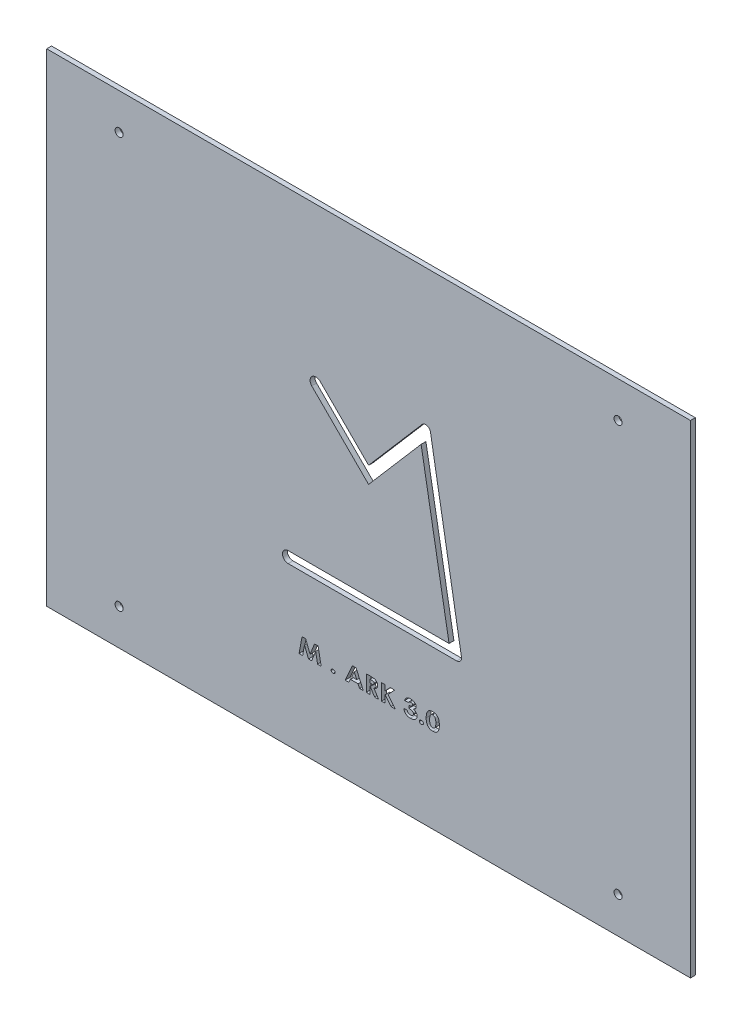
from build123d import *

# Parameters (mm, degrees)
SKETCH1_W           = 400
SKETCH1_H           = 300
BOSS_EXTRUDE1_DEPTH = 3
SKETCH2_R           = 2.5
CUT_EXTRUDE1_DEPTH  = 251.017999352
CUT_EXTRUDE2_DEPTH  = 251.017999352
CUT_EXTRUDE3_DEPTH  = 251.017999352


with BuildPart() as part:
    # Sketch1 → Boss-Extrude1 (new body)
    with BuildSketch(Plane.XY):
        Rectangle(SKETCH1_W, SKETCH1_H)
    extrude(amount=BOSS_EXTRUDE1_DEPTH)

    # Sketch2 → Cut-Extrude1 (cut, through all)
    with BuildSketch(Plane.XY.offset(3)):
        with Locations((155, 127.5)):
            Circle(SKETCH2_R)
        with Locations(Location((-155, 127.5, 0), (0, 0, 180))):
            Circle(SKETCH2_R)
        with Locations((-155, -127.5)):
            Circle(SKETCH2_R)
        with Locations(Location((155, -127.5, 0), (0, 0, 180))):
            Circle(SKETCH2_R)
    extrude(amount=-CUT_EXTRUDE1_DEPTH, mode=Mode.SUBTRACT)

    # Sketch3 → Cut-Extrude2 (cut, through all)
    with BuildSketch(Plane.XY.offset(3)):
        with BuildLine():
            Line((-50, -45), (50, -45))
            Line((50, -45), (32.635182233, 53.480775301))
            Line((32.635182233, 53.480775301), (0, 15.600108984))
            Line((0, 15.600108984), (-35.355339059, 50.955448044))
            ThreePointArc((-35.355339059, 50.955448044), (-35.164401991, 56.09613258), (-30.023717455, 55.905195512))
            Line((-30.023717455, 55.905195512), (0, 25.881478057))
            Line((0, 25.881478057), (33.218849699, 64.43962527))
            ThreePointArc((33.218849699, 64.43962527), (36.291795481, 65.372851519), (38.44782828, 62.992635231))
            Line((38.44782828, 62.992635231), (57.723152972, -48.488879105))
            ThreePointArc((57.723152972, -48.488879105), (57.061939498, -50.932179768), (54.76701437, -52))
            Line((54.76701437, -52), (-50, -52))
            ThreePointArc((-50, -52), (-53.5, -48.5), (-50, -45))
        make_face()
    extrude(amount=-CUT_EXTRUDE2_DEPTH, mode=Mode.SUBTRACT)

    # Sketch4 → Cut-Extrude3 (cut, through all)
    # profile 1 of 8: a face of its own
    with BuildSketch(Plane.XY.offset(3)):
        Polygon((-41.328125, -87), (-39.086538462, -87), (-36.346153846, -93.975160256), (-33.59775641, -87), (-31.368189103, -87), (-29.487179487, -97), (-31.696714744, -97), (-32.884615385, -90.683894231), (-35.374599359, -97), (-37.327724359, -97), (-39.807692308, -90.683894231), (-40.993589744, -97), (-43.205128205, -97), align=None)
    # profile 2 of 8: a face of its own
    with BuildSketch(Plane.XY.offset(3)):
        with BuildLine():
            add(Edge.make_bspline(
                [(-22.051282051, -94.948717949), (-21.965492792, -94.952546553), (-21.798510579, -94.959998637), (-21.557360282, -95.01879729), (-21.33803169, -95.121130381), (-21.143253871, -95.258736103), (-20.978406375, -95.422518732), (-20.857007337, -95.609884484), (-20.782654227, -95.816780635), (-20.773756298, -95.961069257), (-20.769230769, -96.034455128)],
                knots=[0, 0, 0, 0, 1.104023621, 2.148897298, 3.172284594, 4.202907706, 5.206191934, 6.146002102, 7.057047959, 8, 8, 8, 8], degree=3))
            add(Edge.make_bspline(
                [(-20.769230769, -96.034455128), (-20.773732034, -96.107855301), (-20.782582257, -96.252172042), (-20.857481369, -96.459396973), (-20.97821469, -96.64838034), (-21.14323076, -96.813934245), (-21.337375083, -96.954191289), (-21.557745391, -97.055420601), (-21.79816046, -97.117618668), (-21.965429006, -97.124614443), (-22.051282051, -97.128205128)],
                knots=[0, 0, 0, 0, 0.940548371, 1.84927189, 2.79391768, 3.800764035, 4.83372162, 5.854500209, 6.898790635, 8, 8, 8, 8], degree=3))
            add(Edge.make_bspline(
                [(-22.051282051, -97.128205128), (-22.137129782, -97.124606037), (-22.304387975, -97.117593884), (-22.544877073, -97.055512918), (-22.765470913, -96.953622083), (-22.961004493, -96.814530517), (-23.126631533, -96.648927401), (-23.244742455, -96.458776785), (-23.320100559, -96.252244256), (-23.328872091, -96.107879647), (-23.333333333, -96.034455128)],
                knots=[0, 0, 0, 0, 1.100875723, 2.144849751, 3.165319067, 4.204952963, 5.211494265, 6.151288399, 7.059736594, 8, 8, 8, 8], degree=3))
            add(Edge.make_bspline(
                [(-23.333333333, -96.034455128), (-23.328847989, -95.961044524), (-23.32002907, -95.816707273), (-23.245216503, -95.610511181), (-23.126435062, -95.421967893), (-22.96097294, -95.258143226), (-22.764819781, -95.121701974), (-22.545260995, -95.01870547), (-22.304038151, -94.960023325), (-22.137066093, -94.952554932), (-22.051282051, -94.948717949)],
                knots=[0, 0, 0, 0, 0.94266584, 1.85343518, 2.788347505, 3.79132722, 4.828678245, 5.851754927, 6.896311468, 8, 8, 8, 8], degree=3))
        make_face()
    # profile 3 of 8: a face of its own
    with BuildSketch(Plane.XY.offset(3)):
        Polygon((-10.028044872, -87), (-7.792467949, -87), (-3.269230769, -97), (-5.600961538, -97), (-6.510416667, -94.948717949), (-11.312099359, -94.948717949), (-12.219551282, -97), (-14.551282051, -97), align=None)
        Polygon((-8.91025641, -89.682291667), (-10.514823718, -93.153846154), (-7.301682692, -93.153846154), align=None, mode=Mode.SUBTRACT)
    # profile 4 of 8: a face of its own
    with BuildSketch(Plane.XY.offset(3)):
        with BuildLine():
            Line((-1.41025641, -87), (0.985576923, -87))
            add(Edge.make_bspline(
                [(0.985576923, -87), (1.143844199, -87.000492961), (1.448427932, -87.001441659), (1.887875497, -87.016324081), (2.29209751, -87.037071862), (2.660980566, -87.06857244), (2.993750693, -87.110349308), (3.291196299, -87.160211102), (3.554109452, -87.21626818), (3.785364304, -87.286038508), (3.993532596, -87.365199947), (4.187179201, -87.456554328), (4.371370087, -87.557662579), (4.544444005, -87.672822218), (4.707244652, -87.79927066), (4.859887471, -87.937942479), (5.002504161, -88.08863013), (5.13426807, -88.250743335), (5.254387386, -88.421200191), (5.357426327, -88.602020793), (5.445066858, -88.789608289), (5.518567163, -88.9847556), (5.571452591, -89.188559363), (5.61190344, -89.398550952), (5.636663189, -89.616932157), (5.639552353, -89.765026363), (5.641025641, -89.840544872)],
                knots=[0, 0, 0, 0, 1.836570219, 3.53446034, 5.10207051, 6.533260598, 7.829841073, 8.992934726, 10.032625301, 10.947036066, 11.793235874, 12.614808957, 13.429924994, 14.229421483, 15.024587688, 15.82001815, 16.620302857, 17.429949247, 18.242519826, 19.037383916, 19.841635455, 20.64338194, 21.453510251, 22.281780062, 23.123818469, 24, 24, 24, 24], degree=3))
            add(Edge.make_bspline(
                [(5.641025641, -89.840544872), (5.639700988, -89.919414321), (5.637100179, -90.074265819), (5.610290731, -90.301434081), (5.5668406, -90.518804665), (5.503475747, -90.726053816), (5.42677361, -90.924837764), (5.328814401, -91.112710707), (5.215325414, -91.290772343), (5.083101275, -91.458425368), (4.93554255, -91.617306356), (4.766856245, -91.76341326), (4.583273025, -91.902519326), (4.378797911, -92.028007271), (4.158930126, -92.146149863), (3.920886504, -92.254896347), (3.665091635, -92.352624879), (3.486569129, -92.408284344), (3.395432692, -92.436698718)],
                knots=[0, 0, 0, 0, 1.016086139, 1.994973482, 2.943504488, 3.869195015, 4.784910831, 5.685580803, 6.595129019, 7.502394393, 8.433946935, 9.385206858, 10.374891841, 11.399326033, 12.473554863, 13.590341435, 14.769859888, 16, 16, 16, 16], degree=3))
            Line((3.395432692, -92.436698718), (6.217948718, -97))
            Line((6.217948718, -97), (3.760016026, -97))
            Line((3.760016026, -97), (1.063701923, -92.641025641))
            Line((1.063701923, -92.641025641), (0.769230769, -92.641025641))
            Line((0.769230769, -92.641025641), (0.769230769, -97))
            Line((0.769230769, -97), (-1.41025641, -97))
            Line((-1.41025641, -97), (-1.41025641, -87))
        make_face()
        with BuildLine():
            Line((0.769230769, -90.846153846), (1.502403846, -90.846153846))
            add(Edge.make_bspline(
                [(1.502403846, -90.846153846), (1.591883707, -90.845192522), (1.763556746, -90.843348157), (2.010919586, -90.834735591), (2.236057963, -90.814302059), (2.439778838, -90.787993837), (2.621920902, -90.758559376), (2.781305836, -90.714965698), (2.920358792, -90.668720013), (3.038794493, -90.61206344), (3.139465541, -90.546333296), (3.226724421, -90.472412691), (3.29921512, -90.386542966), (3.360955338, -90.292586411), (3.403628226, -90.185664675), (3.438524745, -90.072094241), (3.458907272, -89.947433069), (3.460637886, -89.861318569), (3.461538462, -89.81650641)],
                knots=[0, 0, 0, 0, 1.708363675, 3.277608857, 4.723712974, 6.021838054, 7.199660436, 8.241690857, 9.172961181, 9.993967569, 10.739999558, 11.46313589, 12.168296226, 12.87908003, 13.598837728, 14.357076655, 15.145057537, 16, 16, 16, 16], degree=3))
            add(Edge.make_bspline(
                [(3.461538462, -89.81650641), (3.45969929, -89.763454538), (3.456080663, -89.659073342), (3.413413676, -89.509546122), (3.349115799, -89.369370461), (3.255365373, -89.24457729), (3.142721386, -89.131000341), (3.009655345, -89.035227064), (2.859383338, -88.956265546), (2.719795839, -88.906006995), (2.592130095, -88.874691081), (2.477160464, -88.85296137), (2.343310502, -88.835657359), (2.192425365, -88.819432909), (2.022706278, -88.807721238), (1.835005367, -88.799872694), (1.6286175, -88.796476019), (1.485043251, -88.795421228), (1.41025641, -88.794871795)],
                knots=[0, 0, 0, 0, 0.985252127, 1.938513972, 2.873098658, 3.843165384, 4.828025027, 5.842890392, 6.883115312, 7.980634618, 8.595920604, 9.330050158, 10.158404267, 11.108741491, 12.156004298, 13.326020887, 14.60714262, 16, 16, 16, 16], degree=3))
            Line((1.41025641, -88.794871795), (0.769230769, -88.794871795))
            Line((0.769230769, -88.794871795), (0.769230769, -90.846153846))
        make_face(mode=Mode.SUBTRACT)
    # profile 5 of 8: a face of its own
    with BuildSketch(Plane.XY.offset(3)):
        Polygon((8.076923077, -87), (10.256410256, -87), (10.256410256, -90.371394231), (13.417467949, -87), (16.197916667, -87), (12.049278846, -91.423076923), (16.602564103, -97), (13.956330128, -97), (10.256410256, -92.466746795), (10.256410256, -97), (8.076923077, -97), align=None)
    # profile 6 of 8: a face of its own
    with BuildSketch(Plane.XY.offset(3)):
        with BuildLine():
            Line((24.615384615, -89.435897436), (22.435897436, -89.435897436))
            add(Edge.make_bspline(
                [(22.435897436, -89.435897436), (22.451619837, -89.34605695), (22.482546857, -89.169334678), (22.556337578, -88.914502438), (22.645647584, -88.672545609), (22.756913982, -88.444754686), (22.8871191, -88.230230856), (23.036223151, -88.029365832), (23.202470589, -87.840717401), (23.328104896, -87.729255317), (23.391426282, -87.673076923)],
                knots=[0, 0, 0, 0, 1.067174566, 2.09920409, 3.101182624, 4.083726143, 5.062529949, 6.035131793, 7.009679911, 8, 8, 8, 8], degree=3))
            add(Edge.make_bspline(
                [(23.391426282, -87.673076923), (23.484145868, -87.598323866), (23.668520722, -87.449675834), (23.970491906, -87.261791178), (24.288061556, -87.099383753), (24.625298535, -86.971135455), (24.978517092, -86.866742013), (25.350349108, -86.796640554), (25.73936179, -86.750681565), (26.004804928, -86.745980805), (26.139823718, -86.743589744)],
                knots=[0, 0, 0, 0, 0.963513775, 1.91596748, 2.873425474, 3.847303723, 4.832772883, 5.851708161, 6.907262155, 8, 8, 8, 8], degree=3))
            add(Edge.make_bspline(
                [(26.139823718, -86.743589744), (26.260760658, -86.745878739), (26.49784945, -86.750366163), (26.845746053, -86.786140903), (27.177930399, -86.85001921), (27.496780557, -86.931336905), (27.798948777, -87.044581678), (28.088783259, -87.174965269), (28.361917665, -87.334430147), (28.616188185, -87.516131458), (28.849663836, -87.711554753), (29.052594902, -87.921186261), (29.227429097, -88.137712076), (29.368517708, -88.366196467), (29.47990623, -88.603197333), (29.558444093, -88.849610396), (29.605988825, -89.104870358), (29.612227329, -89.278109504), (29.615384615, -89.365785256)],
                knots=[0, 0, 0, 0, 1.203972995, 2.36030863, 3.476442814, 4.569752457, 5.631894405, 6.684988858, 7.730607218, 8.774702771, 9.793625368, 10.75742121, 11.675248853, 12.558950514, 13.424459788, 14.275965966, 15.127472144, 16, 16, 16, 16], degree=3))
            add(Edge.make_bspline(
                [(29.615384615, -89.365785256), (29.610015432, -89.474499037), (29.599384033, -89.689760763), (29.512820719, -90.004612496), (29.372974395, -90.303679556), (29.177803977, -90.585595157), (28.931598504, -90.847969797), (28.631247009, -91.081313002), (28.283617999, -91.292814884), (28.026419519, -91.403540034), (27.892628205, -91.461137821)],
                knots=[0, 0, 0, 0, 0.902812238, 1.787638331, 2.694283822, 3.636788598, 4.626642246, 5.674130132, 6.790112658, 8, 8, 8, 8], degree=3))
            add(Edge.make_bspline(
                [(27.892628205, -91.461137821), (27.978507877, -91.484535751), (28.146768607, -91.530378415), (28.387725034, -91.620118045), (28.615649818, -91.720181708), (28.829176691, -91.83313606), (29.027112987, -91.961241265), (29.211722389, -92.099161975), (29.383209047, -92.249275577), (29.537082605, -92.413892773), (29.674247002, -92.588382729), (29.798894362, -92.767542811), (29.897936354, -92.958649227), (29.984045418, -93.154539334), (30.046530937, -93.360753), (30.096799326, -93.573087003), (30.121264542, -93.794304246), (30.1258755, -93.943733517), (30.128205128, -94.019230769)],
                knots=[0, 0, 0, 0, 1.161439999, 2.275564601, 3.352689833, 4.409483066, 5.425027258, 6.427468076, 7.415594393, 8.396117101, 9.364043735, 10.311781116, 11.239872671, 12.169273241, 13.101123259, 14.048499788, 15.01402915, 16, 16, 16, 16], degree=3))
            add(Edge.make_bspline(
                [(30.128205128, -94.019230769), (30.125009633, -94.130324511), (30.118691921, -94.349964412), (30.060263065, -94.672017037), (29.968201081, -94.980747081), (29.838748645, -95.276378002), (29.670410668, -95.557723147), (29.467324816, -95.828044444), (29.224120284, -96.082429819), (28.949755785, -96.323016049), (28.646824481, -96.543187889), (28.318806587, -96.732525386), (27.972501973, -96.896870274), (27.605168338, -97.028201856), (27.217693639, -97.130553064), (26.810522781, -97.204212808), (26.382560641, -97.24920096), (26.090523021, -97.25397449), (25.94150641, -97.256410256)],
                knots=[0, 0, 0, 0, 0.904771238, 1.788794425, 2.658307691, 3.52589414, 4.411674647, 5.324918016, 6.275850375, 7.274726454, 8.295875987, 9.322666235, 10.357373388, 11.41613355, 12.497317003, 13.62033306, 14.785738966, 16, 16, 16, 16], degree=3))
            add(Edge.make_bspline(
                [(25.94150641, -97.256410256), (25.800505635, -97.253841249), (25.524529751, -97.24881302), (25.120700188, -97.2058589), (24.736794271, -97.136372801), (24.372582942, -97.038588241), (24.028715893, -96.911010495), (23.702366301, -96.760349453), (23.398560475, -96.576121812), (23.116377706, -96.365927093), (22.85815493, -96.132981407), (22.629951077, -95.877363193), (22.435010973, -95.600102423), (22.267244628, -95.305081059), (22.132586995, -94.988421262), (22.03086337, -94.651077999), (21.957864258, -94.294236557), (21.934809274, -94.04825395), (21.923076923, -93.923076923)],
                knots=[0, 0, 0, 0, 1.163132858, 2.276559241, 3.346385464, 4.379491246, 5.383511434, 6.369379209, 7.340699554, 8.309265972, 9.268764279, 10.205337855, 11.130170369, 12.060239432, 13.000694122, 13.962719923, 14.963257337, 16, 16, 16, 16], degree=3))
            Line((21.923076923, -93.923076923), (24.102564103, -93.923076923))
            add(Edge.make_bspline(
                [(24.102564103, -93.923076923), (24.116401681, -93.98605532), (24.143433086, -94.10908223), (24.197469508, -94.28621867), (24.263371754, -94.450328346), (24.340347042, -94.602533515), (24.427633313, -94.742971507), (24.528292552, -94.869502193), (24.640225063, -94.983083164), (24.802864217, -95.119366788), (25.03519483, -95.259885874), (25.347580704, -95.377551873), (25.693273716, -95.448711357), (25.934476738, -95.457155004), (26.059695513, -95.461538462)],
                knots=[0, 0, 0, 0, 0.847238011, 1.65506076, 2.430783259, 3.168647505, 3.894249557, 4.600105461, 5.288952951, 5.986742919, 7.384996884, 8.832294932, 10.355509216, 12, 12, 12, 12], degree=3))
            add(Edge.make_bspline(
                [(26.059695513, -95.461538462), (26.126521614, -95.460591038), (26.257154551, -95.458738998), (26.448735077, -95.438177604), (26.630837189, -95.404291442), (26.804141139, -95.357707688), (26.970076886, -95.300646509), (27.125920946, -95.225173736), (27.27462012, -95.139735892), (27.412329701, -95.041308132), (27.53867908, -94.934926717), (27.646248626, -94.817694718), (27.740556927, -94.696781423), (27.816424345, -94.568844611), (27.875370313, -94.434870707), (27.91729679, -94.295654679), (27.944829398, -94.150522991), (27.947410494, -94.051408423), (27.948717949, -94.001201923)],
                knots=[0, 0, 0, 0, 1.207695902, 2.360827, 3.478340193, 4.552977425, 5.602922823, 6.645067005, 7.678223387, 8.69981991, 9.701465816, 10.658091572, 11.570750188, 12.46924822, 13.339487348, 14.210145001, 15.093348681, 16, 16, 16, 16], degree=3))
            add(Edge.make_bspline(
                [(27.948717949, -94.001201923), (27.946427917, -93.946245833), (27.941853959, -93.836480181), (27.904440248, -93.676564817), (27.84553538, -93.52222991), (27.760467571, -93.376481778), (27.651892015, -93.236735898), (27.522331789, -93.101903514), (27.364487025, -92.978451204), (27.18807851, -92.857623137), (26.986545711, -92.750867431), (26.765771515, -92.653152078), (26.521385746, -92.574975399), (26.257581512, -92.506051283), (25.972108592, -92.455102468), (25.66643158, -92.418043936), (25.340354776, -92.39056616), (25.115578474, -92.386636163), (25, -92.384615385)],
                knots=[0, 0, 0, 0, 0.712260617, 1.422622151, 2.119222093, 2.848814934, 3.602540981, 4.411216623, 5.267622291, 6.197467531, 7.181999, 8.221696836, 9.325704192, 10.506537076, 11.757125606, 13.084140701, 14.500684618, 16, 16, 16, 16], degree=3))
            Line((25, -92.384615385), (25, -90.717948718))
            add(Edge.make_bspline(
                [(25, -90.717948718), (25.078134891, -90.712773296), (25.229139684, -90.702771191), (25.447674546, -90.68558419), (25.650544761, -90.662658286), (25.837833061, -90.639932572), (26.010166926, -90.611420778), (26.166467437, -90.579801565), (26.308417749, -90.546039225), (26.473065214, -90.496671773), (26.657087411, -90.422640964), (26.856470762, -90.322247621), (27.028740939, -90.204947331), (27.174602161, -90.075505521), (27.288172306, -89.933607327), (27.37327406, -89.787137617), (27.4266963, -89.635162528), (27.432865268, -89.531111202), (27.435897436, -89.479967949)],
                knots=[0, 0, 0, 0, 1.261305243, 2.437619549, 3.530325748, 4.549526295, 5.476041808, 6.342959594, 7.11771268, 7.825439131, 9.109647673, 10.307400883, 11.414149412, 12.457410992, 13.436672637, 14.327804045, 15.178083114, 16, 16, 16, 16], degree=3))
            add(Edge.make_bspline(
                [(27.435897436, -89.479967949), (27.431957966, -89.414587564), (27.424173795, -89.28539961), (27.352422756, -89.101723489), (27.232865826, -88.939844995), (27.07323423, -88.798755105), (26.879170921, -88.680380524), (26.653347393, -88.59705571), (26.400530531, -88.545877457), (26.222886522, -88.541011249), (26.129807692, -88.538461538)],
                knots=[0, 0, 0, 0, 0.873115495, 1.725226968, 2.596508184, 3.546496563, 4.56193057, 5.623390662, 6.75474542, 8, 8, 8, 8], degree=3))
            add(Edge.make_bspline(
                [(26.129807692, -88.538461538), (26.04545482, -88.54157882), (25.879467947, -88.547712906), (25.636123543, -88.595317988), (25.40437962, -88.672908941), (25.189720736, -88.783559194), (24.996187873, -88.915192325), (24.832646061, -89.069056032), (24.703567562, -89.243130746), (24.64463868, -89.37194846), (24.615384615, -89.435897436)],
                knots=[0, 0, 0, 0, 1.084879982, 2.134791974, 3.178249202, 4.21968776, 5.232697662, 6.180875624, 7.096932117, 8, 8, 8, 8], degree=3))
        make_face()
    # profile 7 of 8: a face of its own
    with BuildSketch(Plane.XY.offset(3)):
        with BuildLine():
            add(Edge.make_bspline(
                [(32.820512821, -94.948717949), (32.90630208, -94.952546553), (33.073284293, -94.959998637), (33.31443459, -95.01879729), (33.533763181, -95.121130381), (33.728541, -95.258736103), (33.893388497, -95.422518732), (34.014787535, -95.609884484), (34.089140645, -95.816780635), (34.098038574, -95.961069257), (34.102564103, -96.034455128)],
                knots=[0, 0, 0, 0, 1.104023621, 2.148897298, 3.172284594, 4.202907706, 5.206191934, 6.146002102, 7.057047959, 8, 8, 8, 8], degree=3))
            add(Edge.make_bspline(
                [(34.102564103, -96.034455128), (34.098062838, -96.107855301), (34.089212615, -96.252172042), (34.014313503, -96.459396973), (33.893580182, -96.64838034), (33.728564112, -96.813934245), (33.534419788, -96.954191289), (33.314049481, -97.055420601), (33.073634412, -97.117618668), (32.906365865, -97.124614443), (32.820512821, -97.128205128)],
                knots=[0, 0, 0, 0, 0.940548371, 1.84927189, 2.79391768, 3.800764035, 4.83372162, 5.854500209, 6.898790635, 8, 8, 8, 8], degree=3))
            add(Edge.make_bspline(
                [(32.820512821, -97.128205128), (32.73466509, -97.124606037), (32.567406897, -97.117593884), (32.326917799, -97.055512918), (32.106323959, -96.953622083), (31.910790379, -96.814530517), (31.745163339, -96.648927401), (31.627052417, -96.458776785), (31.551694313, -96.252244256), (31.542922781, -96.107879647), (31.538461538, -96.034455128)],
                knots=[0, 0, 0, 0, 1.100875723, 2.144849751, 3.165319067, 4.204952963, 5.211494265, 6.151288399, 7.059736594, 8, 8, 8, 8], degree=3))
            add(Edge.make_bspline(
                [(31.538461538, -96.034455128), (31.542946882, -95.961044524), (31.551765802, -95.816707273), (31.626578368, -95.610511181), (31.745359809, -95.421967893), (31.910821932, -95.258143226), (32.106975091, -95.121701974), (32.326533876, -95.01870547), (32.56775672, -94.960023325), (32.734728778, -94.952554932), (32.820512821, -94.948717949)],
                knots=[0, 0, 0, 0, 0.94266584, 1.85343518, 2.788347505, 3.79132722, 4.828678245, 5.851754927, 6.896311468, 8, 8, 8, 8], degree=3))
        make_face()
    # profile 8 of 8: a face of its own
    with BuildSketch(Plane.XY.offset(3)):
        with BuildLine():
            add(Edge.make_bspline(
                [(39.835737179, -86.743589744), (39.940631176, -86.74488494), (40.146750821, -86.747430038), (40.450366804, -86.77474525), (40.743288095, -86.816595855), (41.025532396, -86.873329011), (41.295429617, -86.950846392), (41.555003685, -87.042377369), (41.803188475, -87.152798677), (42.040151, -87.279337808), (42.266448166, -87.421538009), (42.478041154, -87.584189771), (42.67755099, -87.763705552), (42.864648534, -87.959402331), (43.034727295, -88.176587808), (43.195130022, -88.408013437), (43.342377665, -88.658110348), (43.474670095, -88.928022132), (43.59399893, -89.220026438), (43.69503453, -89.538581817), (43.783887869, -89.882669813), (43.851947969, -90.255167484), (43.909346327, -90.653914222), (43.944859359, -91.080698885), (43.970316511, -91.533612303), (43.972987163, -91.844377957), (43.974358974, -92.00400641)],
                knots=[0, 0, 0, 0, 0.986878607, 1.939244146, 2.866122373, 3.770685769, 4.645919486, 5.506526465, 6.358927341, 7.19947967, 8.032766199, 8.871060618, 9.707586805, 10.556552813, 11.415253582, 12.300713806, 13.20490608, 14.143531746, 15.127224312, 16.170507414, 17.286127382, 18.469254189, 19.732050249, 21.075816642, 22.49795864, 24, 24, 24, 24], degree=3))
            add(Edge.make_bspline(
                [(43.974358974, -92.00400641), (43.972910558, -92.16562941), (43.970095815, -92.479715252), (43.945814992, -92.93681344), (43.90625356, -93.366586773), (43.851075298, -93.768514844), (43.779103263, -94.143079105), (43.69124908, -94.490365307), (43.588615702, -94.810975096), (43.46684073, -95.104204448), (43.331923569, -95.373004417), (43.187024673, -95.623408669), (43.031519935, -95.855283571), (42.864659889, -96.069375472), (42.685754098, -96.263495423), (42.497826637, -96.441617232), (42.295509196, -96.597179358), (42.084825644, -96.739771822), (41.859103045, -96.860774261), (41.621686966, -96.969112901), (41.368487168, -97.054782793), (41.10308475, -97.13125619), (40.821868935, -97.184979531), (40.5273102, -97.228332493), (40.218065756, -97.251835282), (40.007380311, -97.2548642), (39.899839744, -97.256410256)],
                knots=[0, 0, 0, 0, 1.529996052, 2.973277928, 4.3319599, 5.614837321, 6.812444681, 7.940869391, 9.004374387, 9.996356283, 10.943411785, 11.849826989, 12.733472155, 13.584521289, 14.416696755, 15.230665801, 16.032367232, 16.830096171, 17.636295923, 18.454011992, 19.297680756, 20.164270776, 21.066798043, 22.005483142, 22.981935022, 24, 24, 24, 24], degree=3))
            add(Edge.make_bspline(
                [(39.899839744, -97.256410256), (39.792298675, -97.254853067), (39.580946502, -97.251792696), (39.270386782, -97.228286538), (38.973768088, -97.185125669), (38.689499992, -97.130475757), (38.418734399, -97.055529782), (38.160058762, -96.966028363), (37.91493409, -96.859604854), (37.682736227, -96.737072), (37.464322609, -96.596058382), (37.256720827, -96.43948967), (37.062423015, -96.26520178), (36.881757662, -96.072991282), (36.710587892, -95.866449523), (36.551768483, -95.641862391), (36.408901235, -95.397810879), (36.272109769, -95.138078996), (36.151336492, -94.854564293), (36.050281643, -94.543021704), (35.961483271, -94.204894407), (35.893497482, -93.837004069), (35.836896692, -93.442132365), (35.797867166, -93.018935747), (35.773460469, -92.567865211), (35.770668157, -92.257779019), (35.769230769, -92.098157051)],
                knots=[0, 0, 0, 0, 1.023105099, 2.010724743, 2.960346284, 3.873571896, 4.762817917, 5.630750533, 6.475759109, 7.302737153, 8.125679285, 8.946460815, 9.774219303, 10.605553544, 11.453922483, 12.324617337, 13.219089803, 14.142532874, 15.115994133, 16.146566678, 17.255968662, 18.439589787, 19.703655302, 21.050089352, 22.481484969, 24, 24, 24, 24], degree=3))
            add(Edge.make_bspline(
                [(35.769230769, -92.098157051), (35.772279233, -91.876390498), (35.778162841, -91.448375744), (35.823817931, -90.829541936), (35.901165616, -90.258142128), (36.007305255, -89.733191242), (36.147543188, -89.255941245), (36.316708464, -88.825009087), (36.517319107, -88.439244967), (36.682545093, -88.213462802), (36.762820513, -88.103766026)],
                knots=[0, 0, 0, 0, 1.270554087, 2.452199792, 3.552731428, 4.572428878, 5.517880761, 6.398834259, 7.222069991, 8, 8, 8, 8], degree=3))
            add(Edge.make_bspline(
                [(36.762820513, -88.103766026), (36.857155885, -87.995172643), (37.043456081, -87.780714712), (37.363859988, -87.503877854), (37.707968238, -87.266136631), (38.082782459, -87.075926715), (38.482727496, -86.924458837), (38.910416254, -86.81895418), (39.364465236, -86.756434786), (39.67594666, -86.747945012), (39.835737179, -86.743589744)],
                knots=[0, 0, 0, 0, 0.990681992, 1.956469204, 2.910354335, 3.867787993, 4.846848932, 5.852890592, 6.898529083, 8, 8, 8, 8], degree=3))
        make_face()
        with BuildLine():
            add(Edge.make_bspline(
                [(39.887820513, -88.538461538), (39.794701119, -88.54234069), (39.61127623, -88.549981771), (39.344871042, -88.609535849), (39.094139273, -88.707117235), (38.899930857, -88.82029291), (38.755266327, -88.932227867), (38.652650792, -89.030495297), (38.558693761, -89.144760604), (38.46798076, -89.270238272), (38.38645171, -89.410893082), (38.3121863, -89.56543191), (38.241888986, -89.732776711), (38.179839733, -89.916208719), (38.12548738, -90.117647508), (38.077745975, -90.338909925), (38.038592305, -90.582446225), (38.00416712, -90.846904569), (37.97871928, -91.13360472), (37.960876912, -91.442243058), (37.951401587, -91.772910693), (37.949631413, -92.000662311), (37.948717949, -92.118189103)],
                knots=[0, 0, 0, 0, 1.214825918, 2.392942023, 3.54391286, 4.716047411, 5.312397353, 5.928921511, 6.566233531, 7.241129173, 7.948299778, 8.685150259, 9.478417732, 10.316450957, 11.210975869, 12.20094717, 13.270042938, 14.430220111, 15.681923771, 17.026666981, 18.465669347, 20, 20, 20, 20], degree=3))
            add(Edge.make_bspline(
                [(37.948717949, -92.118189103), (37.949916629, -92.270476768), (37.952216053, -92.562609728), (37.978918093, -92.982365715), (38.019816906, -93.364910726), (38.076843749, -93.711864047), (38.152098799, -94.022091737), (38.243239478, -94.297141462), (38.352237726, -94.535258041), (38.480960547, -94.737268127), (38.622531652, -94.90855723), (38.773730621, -95.056327549), (38.934943317, -95.181461785), (39.105842304, -95.285040181), (39.28760848, -95.362930248), (39.478384063, -95.419847817), (39.679570863, -95.454475498), (39.817572021, -95.459155924), (39.887820513, -95.461538462)],
                knots=[0, 0, 0, 0, 1.67935368, 3.22149899, 4.63658588, 5.921150014, 7.096443814, 8.153749495, 9.112515304, 9.976701786, 10.787628061, 11.558401725, 12.303777516, 13.033787632, 13.756142503, 14.478459833, 15.22547098, 16, 16, 16, 16], degree=3))
            add(Edge.make_bspline(
                [(39.887820513, -95.461538462), (39.95539924, -95.459881617), (40.087358491, -95.456646338), (40.279789904, -95.423478868), (40.461642592, -95.369505407), (40.632381245, -95.292834587), (40.792860659, -95.195657087), (40.941710779, -95.075989806), (41.080807968, -94.93587718), (41.16107834, -94.828882316), (41.201923077, -94.774439103)],
                knots=[0, 0, 0, 0, 1.048278946, 2.046947455, 3.02099404, 3.986174388, 4.94442698, 5.925508864, 6.944416953, 8, 8, 8, 8], degree=3))
            add(Edge.make_bspline(
                [(41.201923077, -94.774439103), (41.249661683, -94.700620546), (41.349184117, -94.546728277), (41.471056183, -94.285943445), (41.568435925, -93.989168372), (41.653923754, -93.65963057), (41.714876637, -93.294098283), (41.764587112, -92.895293295), (41.788282436, -92.46101952), (41.792618665, -92.160274988), (41.794871795, -92.00400641)],
                knots=[0, 0, 0, 0, 0.73363436, 1.529434623, 2.395365967, 3.339496309, 4.370063941, 5.48791158, 6.694704504, 8, 8, 8, 8], degree=3))
            add(Edge.make_bspline(
                [(41.794871795, -92.00400641), (41.793717761, -91.846372547), (41.791495973, -91.542890016), (41.764046921, -91.107275236), (41.726238648, -90.709152376), (41.668975773, -90.349595762), (41.593447147, -90.028120774), (41.5023221, -89.744057632), (41.395063648, -89.497445687), (41.27008359, -89.287409029), (41.128219677, -89.11256316), (40.982803483, -88.957149676), (40.822943157, -88.829504753), (40.656133979, -88.721202347), (40.478090727, -88.638471237), (40.290161229, -88.580107135), (40.092080428, -88.545568503), (39.956733385, -88.540859274), (39.887820513, -88.538461538)],
                knots=[0, 0, 0, 0, 1.705083879, 3.282690406, 4.720299792, 6.030237024, 7.218210755, 8.289614354, 9.253402044, 10.121863153, 10.924008211, 11.685264082, 12.4197249, 13.131122611, 13.832435875, 14.536163306, 15.254677544, 16, 16, 16, 16], degree=3))
        make_face(mode=Mode.SUBTRACT)
    extrude(amount=-CUT_EXTRUDE3_DEPTH, mode=Mode.SUBTRACT)


with BuildPart() as cut_extrude3_piece_1:
    # of the separate pieces the step leaves, piece 1, a body of its own (cut_extrude3_pieces)
    add(part.part.solids().sort_by_distance((-200, -150, 0))[0])


with BuildPart() as cut_extrude3_piece_2:
    # of the separate pieces the step leaves, piece 2, a body of its own (cut_extrude3_pieces)
    add(part.part.solids().sort_by_distance((37.948717949, -92.118189103, 0))[0])


with BuildPart() as cut_extrude3_piece_3:
    # of the separate pieces the step leaves, piece 3, a body of its own (cut_extrude3_pieces)
    add(part.part.solids().sort_by_distance((-7.301682692, -93.153846154, 0))[0])


with BuildPart() as cut_extrude3_piece_4:
    # of the separate pieces the step leaves, piece 4, a body of its own (cut_extrude3_pieces)
    add(part.part.solids().sort_by_distance((0.769230769, -88.794871795, 0))[0])


solid = Compound([cut_extrude3_piece_1.part, cut_extrude3_piece_2.part, cut_extrude3_piece_3.part, cut_extrude3_piece_4.part])
